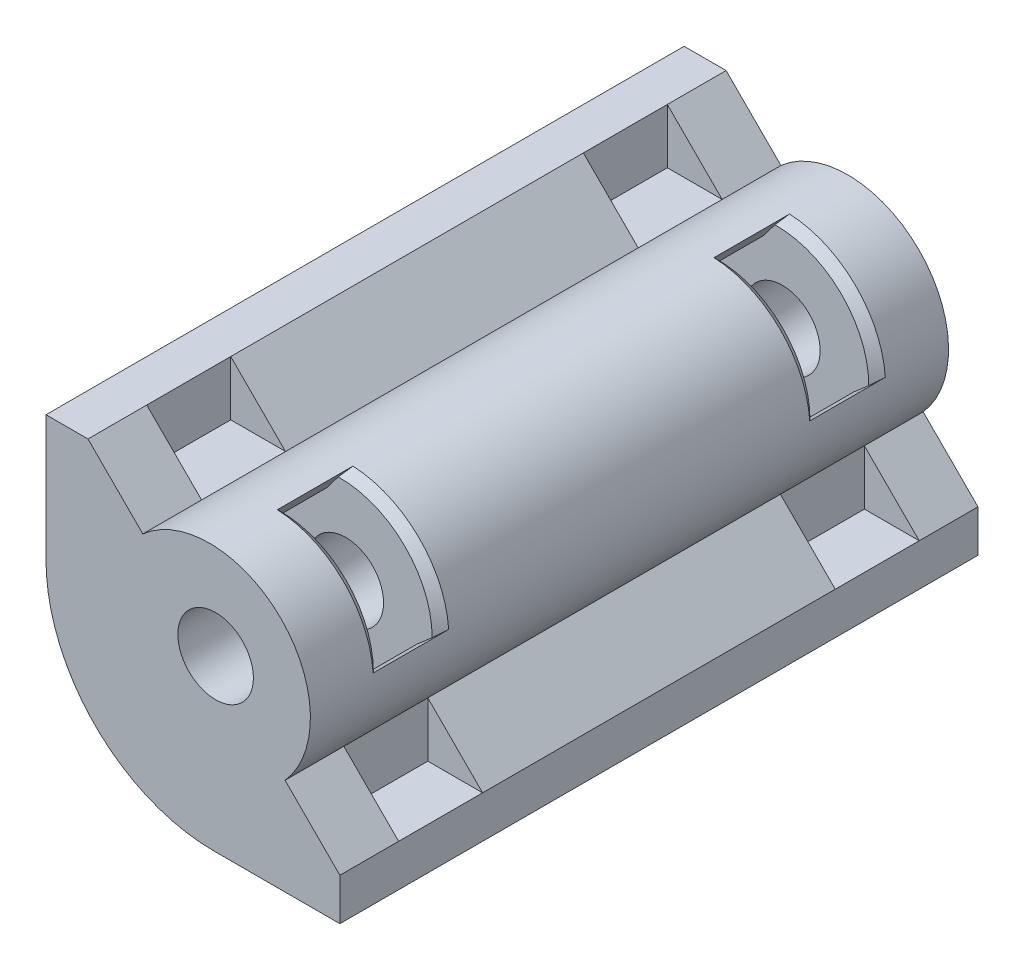
from build123d import *

# Parameters (mm, degrees)
SKETCH1_R                = 2.25
CORNER_DEPTH             = 19
NUT_START                = -6
NUT_DEPTH                = 1.75
CHAMFER1_SIZE            = 0.5
CUT_EXTRUDE1_START       = -6
CUT_EXTRUDE1_DEPTH       = 2.5
CHAMFER1_OF_MIRROR1_SIZE = 0.5


with BuildPart() as part:
    # Sketch1 → corner (new, symmetric)
    with BuildSketch(Plane.XY):
        with BuildLine():
            Line((17.5, 2.5), (14.235015678, 5.764984322))
            ThreePointArc((14.235015678, 5.764984322), (13.988392374, 13.988392374), (5.764984322, 14.235015678))
            Line((5.764984322, 14.235015678), (2.5, 17.5))
            Line((2.5, 17.5), (0, 17.5))
            Line((0, 17.5), (0, 10))
            ThreePointArc((0, 10), (2.928932188, 2.928932188), (10, 0))
            Line((10, 0), (17.5, 0))
            Line((17.5, 0), (17.5, 2.5))
        make_face()
        with Locations((10.1, 10.1)):
            Circle(SKETCH1_R, mode=Mode.SUBTRACT)
    extrude(amount=CORNER_DEPTH, both=True)

    # Sketch4 → nut (cut, symmetric)
    with BuildSketch(Plane.XY.offset(19).offset(NUT_START)):
        Polygon((8.964337735, 14.338349272), (12.289329799, 18.716832073), (18.544552679, 12.601797863), (14.338349272, 8.964337735), (11.235662265, 5.861650728), (6.997312992, 6.997312992), (5.861650728, 11.235662265), align=None)
    nut = extrude(amount=NUT_DEPTH, both=True, mode=Mode.SUBTRACT)

    # Chamfer1
    chamfer1_edges = [part.edges().sort_by_distance(p)[0] for p in [
        (13.938348825, 14.037852483, 14.75),
        (13.938348825, 14.037852483, 11.25),
    ]]
    chamfer(chamfer1_edges, length=CHAMFER1_SIZE)

    # Sketch6 → Cut-Extrude1 (cut, symmetric)
    with BuildSketch(Plane.XY.offset(19).offset(CUT_EXTRUDE1_START)):
        Polygon((2.5, 17.5), (2.5, 14.235015678), (5.764984322, 14.235015678), align=None)
        Polygon((14.235015678, 5.764984322), (14.235015678, 2.5), (17.5, 2.5), align=None)
    cut_extrude1 = extrude(amount=CUT_EXTRUDE1_DEPTH, both=True, mode=Mode.SUBTRACT)

    # Mirror1: nut, Cut-Extrude1 across plane
    add(nut.mirror(Plane.XY), mode=Mode.SUBTRACT)
    add(cut_extrude1.mirror(Plane.XY), mode=Mode.SUBTRACT)

    # Chamfer1 of Mirror1
    chamfer1_of_mirror1_edges = [part.edges().sort_by_distance(p)[0] for p in [
        (13.938348825, 14.037852483, -14.75),
        (13.938348825, 14.037852483, -11.25),
    ]]
    chamfer(chamfer1_of_mirror1_edges, length=CHAMFER1_OF_MIRROR1_SIZE)


solid = part.part
